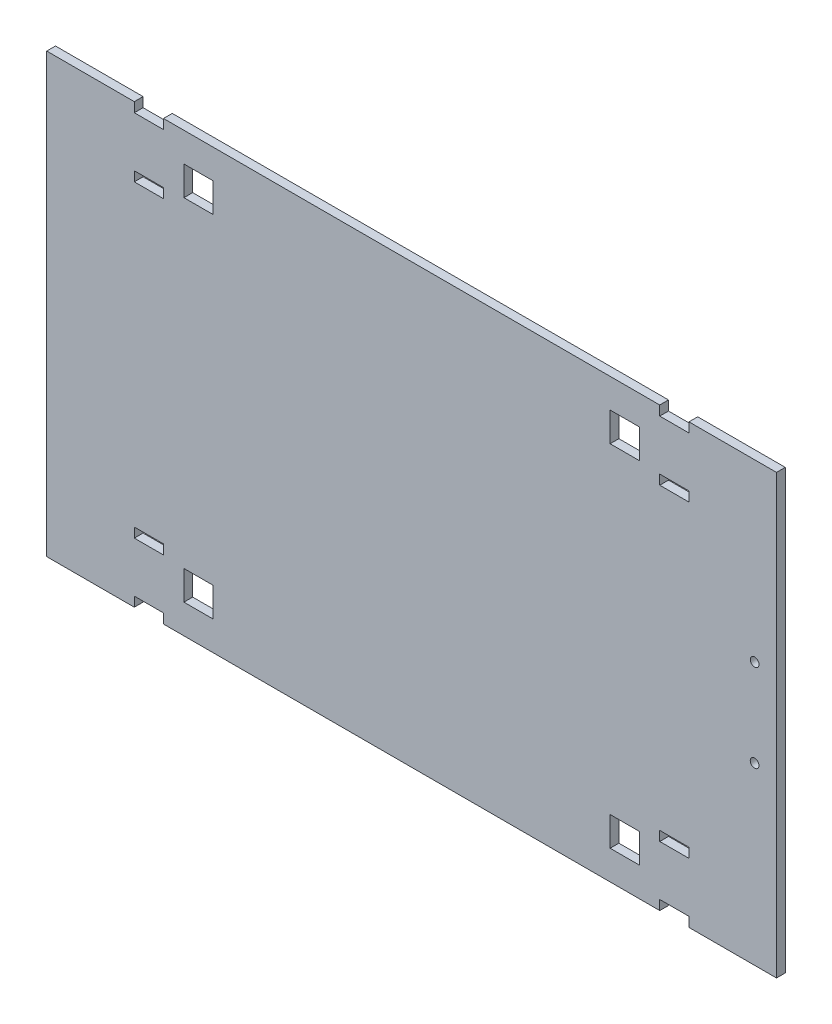
from build123d import *

# Parameters (mm, degrees)
SKETCH2_W               = 250
SKETCH2_H               = 150
BOSS_EXTRUDE1_DEPTH     = 3
SKETCH3_W               = 10
SKETCH3_H               = 3.3
CUT_EXTRUDE1_DEPTH      = 146.804663849
LPATTERN1_COUNT         = 2
LPATTERN1_PITCH         = 20.5
SKETCH4_W               = 10
SKETCH4_H               = 10
CUT_EXTRUDE2_DEPTH      = 146.804663849
MIRROR1_COPY_1_SKETCH_W = 10
MIRROR1_COPY_1_SKETCH_H = 3.3
MIRROR1_COPY_1_DEPTH    = 146.804663849
MIRROR2_COPY_1_SKETCH_W = 10
MIRROR2_COPY_1_SKETCH_H = 3.3
MIRROR2_COPY_1_DEPTH    = 146.804663849
MIRROR2_COPY_2_SKETCH_W = 10
MIRROR2_COPY_2_SKETCH_H = 3.3
MIRROR2_COPY_2_DEPTH    = 146.804663849
MIRROR2_COPY_3_SKETCH_W = 10
MIRROR2_COPY_3_SKETCH_H = 10
MIRROR2_COPY_3_DEPTH    = 146.804663849
MIRROR2_COPY_4_SKETCH_W = 10
MIRROR2_COPY_4_SKETCH_H = 3.3
MIRROR2_COPY_4_DEPTH    = 146.804663849
SKETCH6_R               = 1.5
CUT_EXTRUDE4_DEPTH      = 146.804663849


with BuildPart() as part:
    # Sketch2 → Boss-Extrude1 (new body)
    with BuildSketch(Plane.XY):
        Rectangle(SKETCH2_W, SKETCH2_H)
    extrude(amount=BOSS_EXTRUDE1_DEPTH)

    # Sketch3 → Cut-Extrude1 (cut, symmetric)
    with BuildSketch(Plane(origin=(0, 0, 0), x_dir=(-1, 0, 0), z_dir=(0, 0, -1))):
        with Locations((-90, 73.35)):
            Rectangle(SKETCH3_W, SKETCH3_H)
    cut_extrude1 = extrude(amount=CUT_EXTRUDE1_DEPTH, both=True, mode=Mode.SUBTRACT)

    # LPattern1: Cut-Extrude1 ×2
    with Locations(*[(0, -i * LPATTERN1_PITCH, 0) for i in range(1, LPATTERN1_COUNT)]):
        add(cut_extrude1, mode=Mode.SUBTRACT)

    # Sketch4 → Cut-Extrude2 (cut, through all)
    with BuildSketch(Plane(origin=(0, 0, 0), x_dir=(-1, 0, 0), z_dir=(0, 0, -1))):
        with Locations((-73, 60)):
            Rectangle(SKETCH4_W, SKETCH4_H)
    cut_extrude2 = extrude(amount=-CUT_EXTRUDE2_DEPTH, mode=Mode.SUBTRACT)

    # Mirror1: Cut-Extrude1, Cut-Extrude2 across plane
    add(cut_extrude1.mirror(Plane.ZX), mode=Mode.SUBTRACT)
    add(cut_extrude2.mirror(Plane.ZX), mode=Mode.SUBTRACT)

    # Mirror1 copy 1 sketch → Mirror1 copy 1 (cut, symmetric)
    with BuildSketch(Plane(origin=(0, 20.5, 0), x_dir=(-1, 0, 0), z_dir=(0, 0, -1))):
        with Locations((-90, -73.35)):
            Rectangle(MIRROR1_COPY_1_SKETCH_W, MIRROR1_COPY_1_SKETCH_H)
    extrude(amount=MIRROR1_COPY_1_DEPTH, both=True, mode=Mode.SUBTRACT)

    # Mirror2: Cut-Extrude1, Cut-Extrude2 across plane
    add(cut_extrude1.mirror(Plane(origin=(0, 0, 0), x_dir=(0, 0, 1), z_dir=(1, 0, 0))), mode=Mode.SUBTRACT)
    add(cut_extrude2.mirror(Plane(origin=(0, 0, 0), x_dir=(0, 0, 1), z_dir=(1, 0, 0))), mode=Mode.SUBTRACT)

    # Mirror2 copy 1 sketch → Mirror2 copy 1 (cut, symmetric)
    with BuildSketch(Plane(origin=(0, -20.5, 0), x_dir=(1, 0, 0), z_dir=(0, 0, -1))):
        with Locations((-90, -73.35)):
            Rectangle(MIRROR2_COPY_1_SKETCH_W, MIRROR2_COPY_1_SKETCH_H)
    extrude(amount=MIRROR2_COPY_1_DEPTH, both=True, mode=Mode.SUBTRACT)

    # Mirror2 copy 2 sketch → Mirror2 copy 2 (cut, symmetric)
    with BuildSketch(Plane(origin=(0, 0, 0), x_dir=(1, 0, 0), z_dir=(0, 0, -1))):
        with Locations((-90, 73.35)):
            Rectangle(MIRROR2_COPY_2_SKETCH_W, MIRROR2_COPY_2_SKETCH_H)
    extrude(amount=MIRROR2_COPY_2_DEPTH, both=True, mode=Mode.SUBTRACT)

    # Mirror2 copy 3 sketch → Mirror2 copy 3 (cut, through all)
    with BuildSketch(Plane(origin=(0, 0, 0), x_dir=(1, 0, 0), z_dir=(0, 0, -1))):
        with Locations((-73, 60)):
            Rectangle(MIRROR2_COPY_3_SKETCH_W, MIRROR2_COPY_3_SKETCH_H)
    extrude(amount=-MIRROR2_COPY_3_DEPTH, mode=Mode.SUBTRACT)

    # Mirror2 copy 4 sketch → Mirror2 copy 4 (cut, symmetric)
    with BuildSketch(Plane(origin=(0, 20.5, 0), x_dir=(1, 0, 0), z_dir=(0, 0, -1))):
        with Locations((-90, 73.35)):
            Rectangle(MIRROR2_COPY_4_SKETCH_W, MIRROR2_COPY_4_SKETCH_H)
    extrude(amount=MIRROR2_COPY_4_DEPTH, both=True, mode=Mode.SUBTRACT)

    # Sketch6 → Cut-Extrude4 (cut, symmetric)
    with BuildSketch(Plane(origin=(0, 0, 0), x_dir=(-1, 0, 0), z_dir=(0, 0, -1))):
        with Locations((-117.5, 15)):
            Circle(SKETCH6_R)
    cut_extrude4 = extrude(amount=CUT_EXTRUDE4_DEPTH, both=True, mode=Mode.SUBTRACT)

    # Mirror3: Cut-Extrude4 across plane
    add(cut_extrude4.mirror(Plane.ZX), mode=Mode.SUBTRACT)


solid = part.part
